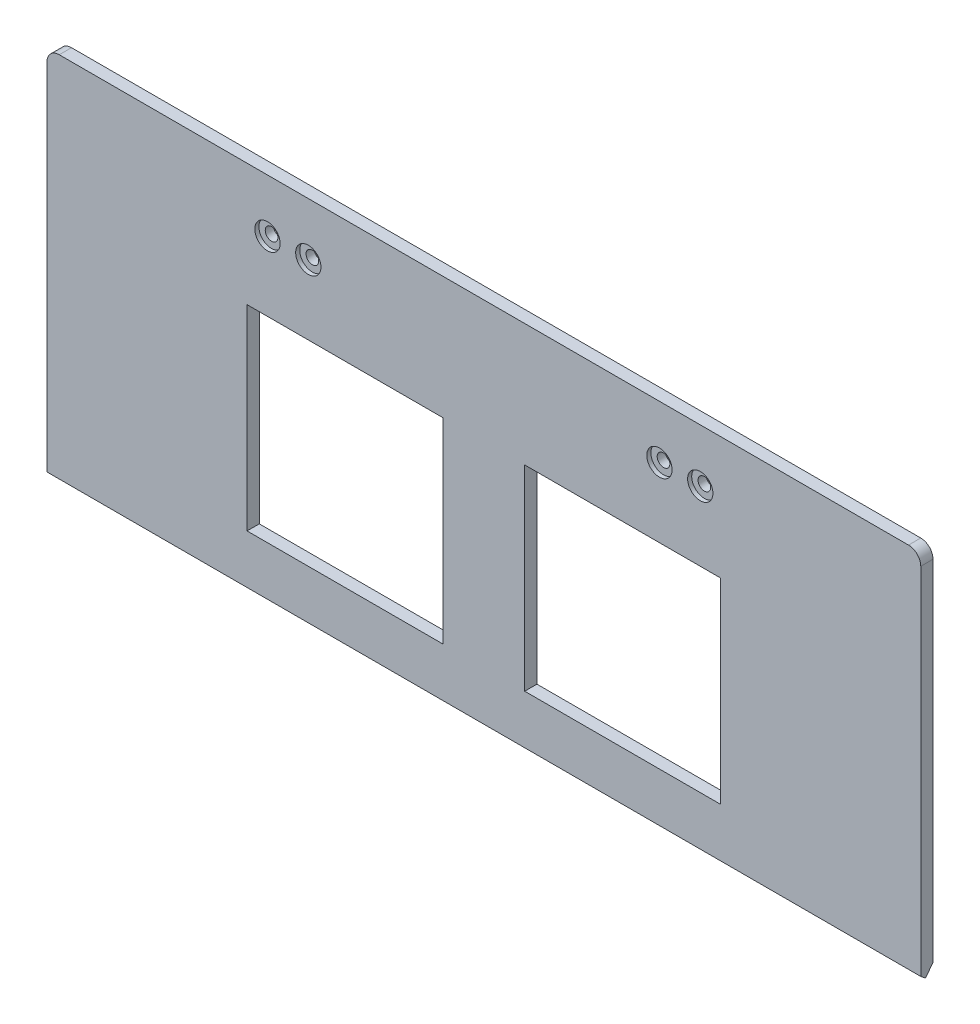
from build123d import *

# Parameters (mm, degrees)
SKETCH_2_W           = 214
SKETCH_2_H           = 90
EXTRUDE_5_DEPTH      = 3
SKETCH_14_R          = 1.55
CUT_EXTRUDE_12_DEPTH = 117.116320989
SKETCH_15_R          = 3.1
CUT_EXTRUDE_14_DEPTH = 1
SKETCH_11_W          = 48
SKETCH_11_H          = 48
CUT_EXTRUDE_15_DEPTH = 117.116320989
EXTRUDE_6_DEPTH      = 214
EXTRUDE_7_DEPTH      = 214
SKETCH_13_R          = 1.75
CUT_EXTRUDE_16_DEPTH = 134.72337904
SKETCH_23_W          = 35
SKETCH_23_H          = 23.89847847
CUT_EXTRUDE_17_DEPTH = 135.831639748
FILLET_3_R           = 3
FILLET_4_R           = 3


with BuildPart() as part:
    # 草图2 → 凸台-拉伸5 (new body)
    with BuildSketch(Plane.XY):
        Rectangle(SKETCH_2_W, SKETCH_2_H)
    extrude(amount=-EXTRUDE_5_DEPTH)

    # 草图14 → 切除-拉伸12 (cut, through all)
    with BuildSketch(Plane(origin=(0, 0, -3), x_dir=(-1, 0, 0), z_dir=(0, 0, -1))):
        with Locations((-53, 32)):
            Circle(SKETCH_14_R)
        with Locations((-43, 32)):
            Circle(SKETCH_14_R)
        with Locations((43, 32)):
            Circle(SKETCH_14_R)
        with Locations((53, 32)):
            Circle(SKETCH_14_R)
    extrude(amount=-CUT_EXTRUDE_12_DEPTH, mode=Mode.SUBTRACT)

    # 草图15 → 切除-拉伸14 (cut)
    with BuildSketch(Plane.XY):
        with Locations((53, 32)):
            Circle(SKETCH_15_R)
        with Locations((43, 32)):
            Circle(SKETCH_15_R)
        with Locations((-43, 32)):
            Circle(SKETCH_15_R)
        with Locations((-53, 32)):
            Circle(SKETCH_15_R)
    extrude(amount=-CUT_EXTRUDE_14_DEPTH, mode=Mode.SUBTRACT)

    # 草图11 → 切除-拉伸15 (cut, through all)
    with BuildSketch(Plane(origin=(0, 0, -3), x_dir=(-1, 0, 0), z_dir=(0, 0, -1))):
        with Locations((-34, -9)):
            Rectangle(SKETCH_11_W, SKETCH_11_H)
        with Locations((34, -9)):
            Rectangle(SKETCH_11_W, SKETCH_11_H)
    extrude(amount=-CUT_EXTRUDE_15_DEPTH, mode=Mode.SUBTRACT)

    # 草图21 → 凸台-拉伸6 (add, through all)
    with BuildSketch(Plane(origin=(107, 0, 0), x_dir=(0, 0, -1), z_dir=(1, 0, 0))):
        Polygon((0, -45), (19.987130176, -60.615657522), (21.124247333, -59.160213932), (3, -45), align=None)
    extrude(amount=-EXTRUDE_6_DEPTH)

    # 草图22 → 凸台-拉伸7 (add, through all)
    with BuildSketch(Plane(origin=(107, 0, 0), x_dir=(0, 0, -1), z_dir=(1, 0, 0))):
        Polygon((3, -43.540629053), (21.83225803, -58.254001566), (21.124247333, -59.160213932), (3, -45), align=None)
    extrude(amount=-EXTRUDE_7_DEPTH)

    # 草图13 → 切除-拉伸16 (cut, through all)
    with BuildSketch(Plane(origin=(0, -24.123766801, 18.847552259), x_dir=(1, 0, 0), z_dir=(0, 0.788010753606719, -0.615661475325662))):
        with Locations(Location((55.5, 40.277161152, 0), (0, 0, 270))):
            Circle(SKETCH_13_R)
        with Locations(Location((18.5, 40.277161152, 0), (0, 0, 270))):
            Circle(SKETCH_13_R)
        with Locations(Location((-18.5, 40.277161152, 0), (0, 0, 270))):
            Circle(SKETCH_13_R)
        with Locations(Location((-55.5, 40.277161152, 0), (0, 0, 270))):
            Circle(SKETCH_13_R)
    extrude(amount=-CUT_EXTRUDE_16_DEPTH, mode=Mode.SUBTRACT)

    # 草图23 → 切除-拉伸17 (cut, through all)
    with BuildSketch(Plane(origin=(0, -25.581586695, 19.986525988), x_dir=(1, 0, 0), z_dir=(0, 0.788010753606719, -0.6156614753256621))):
        with Locations((-89.5, 41.119559415)):
            Rectangle(SKETCH_23_W, SKETCH_23_H)
        with Locations((89.5, 41.119559415)):
            Rectangle(SKETCH_23_W, SKETCH_23_H)
    extrude(amount=-CUT_EXTRUDE_17_DEPTH, mode=Mode.SUBTRACT)

    # 圆角3
    fillet_3_edges = [part.edges().sort_by_distance(p)[0] for p in [
        (-107, 45, -1.5),
    ]]
    fillet(fillet_3_edges, radius=FILLET_3_R)

    # 圆角4
    fillet_4_edges = [part.edges().sort_by_distance(p)[0] for p in [
        (107, 45, -1.5),
    ]]
    fillet(fillet_4_edges, radius=FILLET_4_R)


solid = part.part
